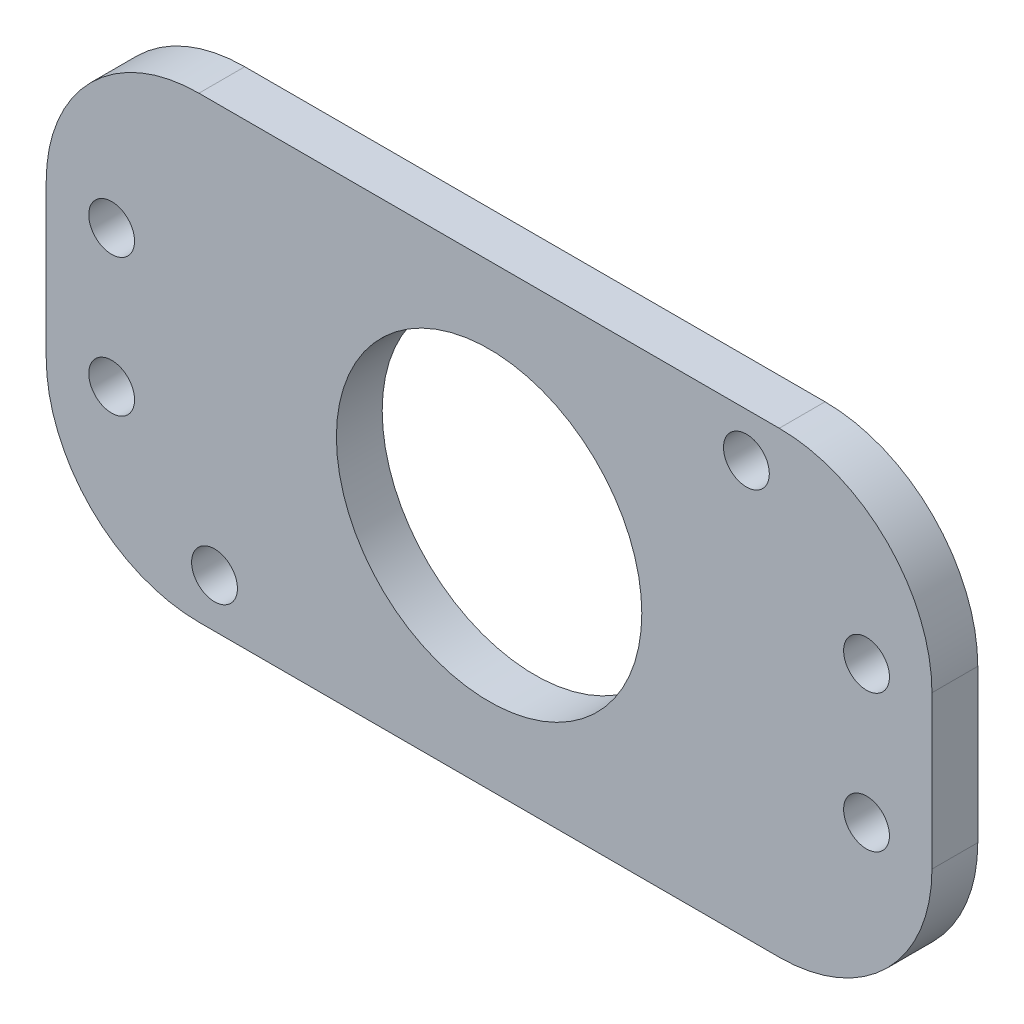
from build123d import *

# Parameters (mm, degrees)
SKETCH1_W           = 58
SKETCH1_H           = 30
BOSS_EXTRUDE1_DEPTH = 3
FILLET1_R           = 10
SKETCH2_R           = 1.5
CUT_EXTRUDE1_DEPTH  = 3
SKETCH3_R           = 1.5
CUT_EXTRUDE2_DEPTH  = 3
SKETCH4_R           = 10
CUT_EXTRUDE3_DEPTH  = 10


with BuildPart() as part:
    # Sketch1 → Boss-Extrude1 (new body)
    with BuildSketch(Plane.XY):
        with Locations((-7.345808821, 32.102080843)):
            Rectangle(SKETCH1_W, SKETCH1_H)
    extrude(amount=BOSS_EXTRUDE1_DEPTH)

    # Fillet1
    fillet1_edges = [part.edges().sort_by_distance(p)[0] for p in [
        (21.654191179, 17.102080843, 1.5),
        (-36.345808821, 17.102080843, 1.5),
        (-36.345808821, 47.102080843, 1.5),
        (21.654191179, 47.102080843, 1.5),
    ]]
    fillet(fillet1_edges, radius=FILLET1_R)

    # Sketch2 → Cut-Extrude1 (cut)
    with BuildSketch(Plane.XY.offset(3)):
        with Locations((17.369191179, 27.602080843)):
            Circle(SKETCH2_R)
        with Locations((17.369191179, 36.602080843)):
            Circle(SKETCH2_R)
    cut_extrude1 = extrude(amount=-CUT_EXTRUDE1_DEPTH, mode=Mode.SUBTRACT)

    # Mirror1: Cut-Extrude1 across plane
    add(cut_extrude1.mirror(Plane(origin=(-7.345808821, 0, 0), x_dir=(0, 0, 1), z_dir=(1, 0, 0))), mode=Mode.SUBTRACT)

    # Sketch3 → Cut-Extrude2 (cut)
    with BuildSketch(Plane.XY.offset(3)):
        with Locations((-25.326377841, 20.27169556)):
            Circle(SKETCH3_R)
        with Locations((9.503472923, 44.194442915)):
            Circle(SKETCH3_R)
    extrude(amount=-CUT_EXTRUDE2_DEPTH, mode=Mode.SUBTRACT)

    # Sketch4 → Cut-Extrude3 (cut)
    with BuildSketch(Plane.XY.offset(3)):
        with Locations((-7.345808821, 32.102080843)):
            Circle(SKETCH4_R)
    extrude(amount=-CUT_EXTRUDE3_DEPTH, mode=Mode.SUBTRACT)


solid = part.part
